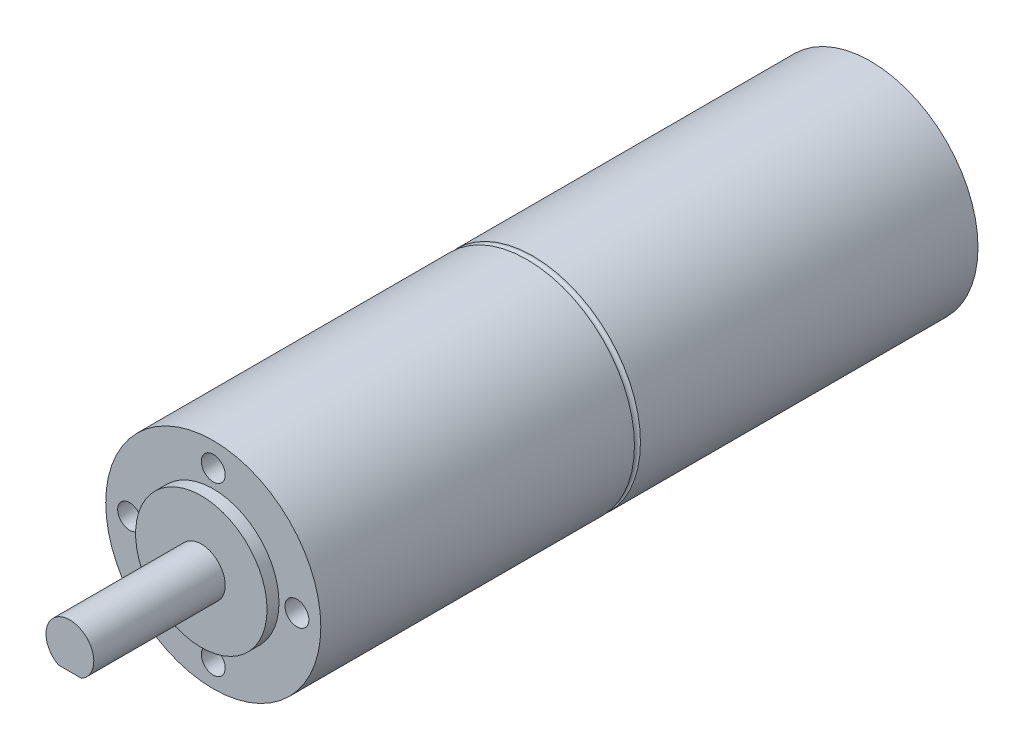
from build123d import *

# Parameters (mm, degrees)
SKETCH1_R           = 18
BOSS_EXTRUDE1_DEPTH = 110
SKETCH2_R           = 0.5
SKETCH3_R           = 11
BOSS_EXTRUDE2_DEPTH = 2
SKETCH4_R           = 4
BOSS_EXTRUDE3_DEPTH = 22
CUT_EXTRUDE1_START  = -15
CUT_EXTRUDE1_DEPTH  = 15
SKETCH6_R           = 5
BOSS_EXTRUDE4_DEPTH = 1
SKETCH7_R           = 2
CUT_EXTRUDE2_DEPTH  = 10


with BuildPart() as part:
    # Sketch1 → Boss-Extrude1 (new body)
    with BuildSketch(Plane.XY):
        Circle(SKETCH1_R)
    extrude(amount=BOSS_EXTRUDE1_DEPTH)

    # Sketch2 → Cut-Revolve1 (revolve, cut)
    with BuildSketch(Plane(origin=(0, 0, 0), x_dir=(1, 0, 0), z_dir=(0, 1, 0)), mode=Mode.PRIVATE) as cut_revolve1_sk:
        with Locations((18, -57)):
            Circle(SKETCH2_R)
    revolve(cut_revolve1_sk.sketch.rotate(Axis((0, 0, 0), (0, 0, 1)), 180), axis=Axis((0, 0, 0), (0, 0, 1)), mode=Mode.SUBTRACT)

    # Sketch3 → Boss-Extrude2 (add)
    with BuildSketch(Plane.XY.offset(110)):
        Circle(SKETCH3_R)
    extrude(amount=BOSS_EXTRUDE2_DEPTH)

    # Sketch4 → Boss-Extrude3 (add)
    with BuildSketch(Plane.XY.offset(112)):
        Circle(SKETCH4_R)
    extrude(amount=BOSS_EXTRUDE3_DEPTH)

    # Sketch5 → Cut-Extrude1 (cut)
    with BuildSketch(Plane.XY.offset(134).offset(CUT_EXTRUDE1_START)):
        with BuildLine():
            Line((-1.936491673, -3.5), (1.936491673, -3.5))
            ThreePointArc((1.936491673, -3.5), (0, -4), (-1.936491673, -3.5))
        make_face()
    extrude(amount=CUT_EXTRUDE1_DEPTH, mode=Mode.SUBTRACT)

    # Sketch6 → Boss-Extrude4 (add)
    with BuildSketch(Plane(origin=(0, 0, 0), x_dir=(-1, 0, 0), z_dir=(0, 0, -1))):
        Circle(SKETCH6_R)
    extrude(amount=BOSS_EXTRUDE4_DEPTH)

    # Sketch7 → Cut-Extrude2 (cut)
    with BuildSketch(Plane.XY.offset(110)):
        with Locations((14, 0)):
            Circle(SKETCH7_R)
        with Locations((0, -14)):
            Circle(SKETCH7_R)
        with Locations((-14, 0)):
            Circle(SKETCH7_R)
        with Locations((0, 14)):
            Circle(SKETCH7_R)
    extrude(amount=-CUT_EXTRUDE2_DEPTH, mode=Mode.SUBTRACT)


solid = part.part
